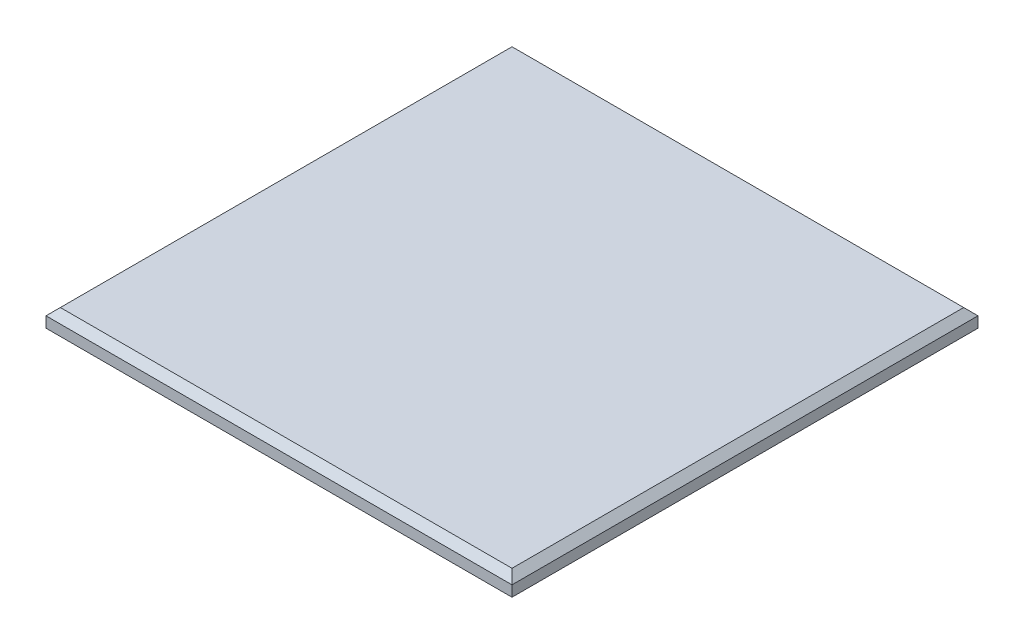
from build123d import *

# Parameters (mm, degrees)
SKETCH_1_W      = 130
SKETCH_1_H      = 130
EXTRUDE_1_DEPTH = 5
SKETCH_2_W      = 1
SKETCH_2_H      = 17.945111322
EXTRUDE_2_DEPTH = 8
SKETCH_3_R      = 2.5
EXTRUDE_3_DEPTH = 43
CHAMFER_1_SIZE  = 2


with BuildPart() as part:
    # 草图1 → 凸台-拉伸1 (new body)
    with BuildSketch(Plane(origin=(0, 0, 0), x_dir=(1, 0, 0), z_dir=(0, 1, 0))):
        with Locations((-0.501834335, 0.116589736)):
            Rectangle(SKETCH_1_W, SKETCH_1_H)
    extrude(amount=EXTRUDE_1_DEPTH)

    # 草图2 → 凸台-拉伸2 (add)
    with BuildSketch(Plane.XZ):
        with Locations((21.735, 0)):
            Rectangle(SKETCH_2_W, SKETCH_2_H)
        with Locations((-21.735, 0)):
            Rectangle(SKETCH_2_W, SKETCH_2_H)
    extrude(amount=EXTRUDE_2_DEPTH)

    # 草图3 → 凸台-拉伸3 (add)
    with BuildSketch(Plane.ZY.offset(22.235)):
        with Locations((0, -3.784370538)):
            Circle(SKETCH_3_R)
    extrude(amount=-EXTRUDE_3_DEPTH)

    # 倒角1
    chamfer_1_edges = [part.edges().sort_by_distance(p)[0] for p in [
        (64.498165665, 5, -0.116589736),
        (-0.501834335, 5, -65.116589736),
        (-65.501834335, 5, -0.116589736),
        (-0.501834335, 5, 64.883410264),
    ]]
    chamfer(chamfer_1_edges, length=CHAMFER_1_SIZE)


solid = part.part
